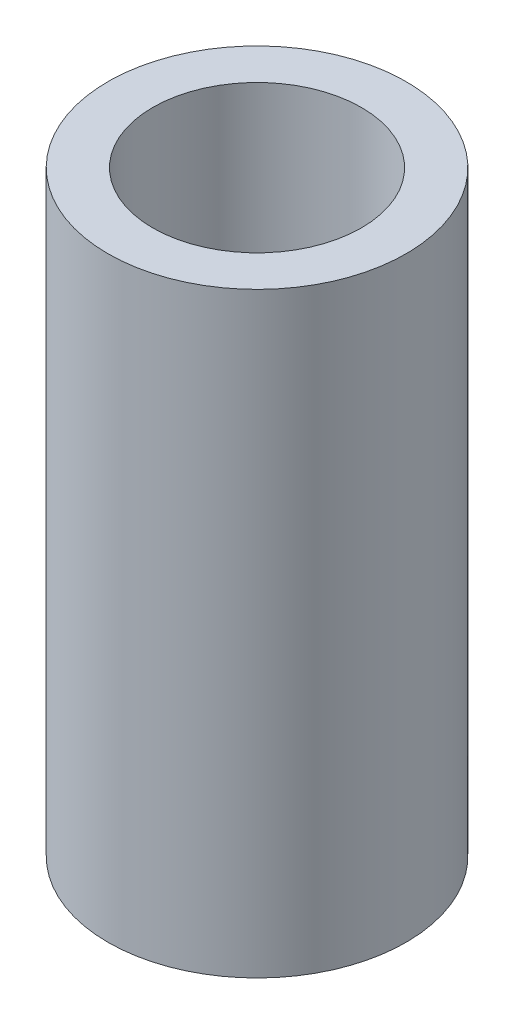
from build123d import *

# Parameters (mm, degrees)
SKETCH1_R           = 2.5
SKETCH1_R_2         = 1.75
BOSS_EXTRUDE1_DEPTH = 10


with BuildPart() as part:
    # Sketch1 → Boss-Extrude1 (new body)
    with BuildSketch(Plane(origin=(0, 0, 0), x_dir=(1, 0, 0), z_dir=(0, 1, 0))):
        with Locations(Location((0, 0, 0), (0, 0, 270))):
            Circle(SKETCH1_R)
        with Locations(Location((0, 0, 0), (0, 0, 270))):
            Circle(SKETCH1_R_2, mode=Mode.SUBTRACT)
    extrude(amount=BOSS_EXTRUDE1_DEPTH)


solid = part.part
